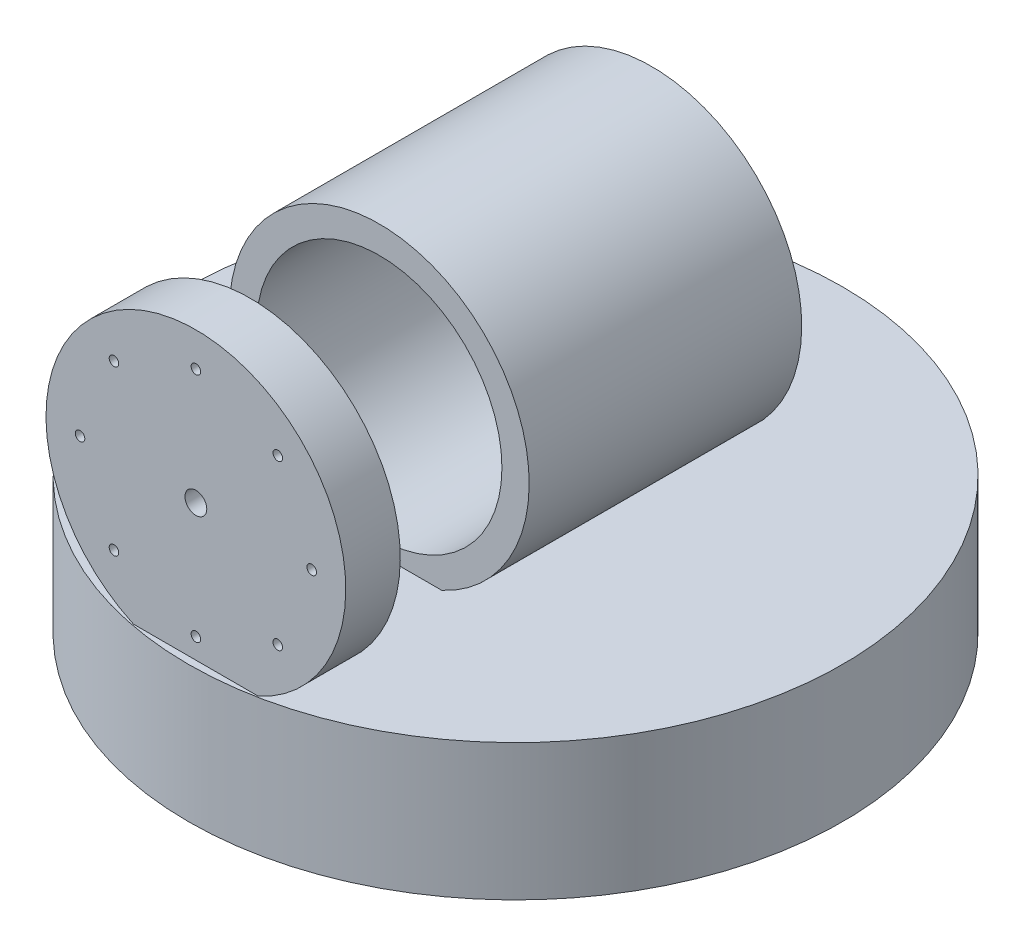
from build123d import *

# Parameters (mm, degrees)
SKETCH_1_R             = 120
EXTRUDE_1_DEPTH        = 50
EXTRUDE_1_2_DEPTH      = 50
EXTRUDE_1_2_DEPTH_BACK = 50
SKETCH_2_R             = 55
SKETCH_2_R_2           = 45
SKETCH_7_R             = 2
CUT_EXTRUDE_2_DEPTH    = 3
SKETCH_8_R             = 55
EXTRUDE_2_DEPTH        = 20
SKETCH_9_R             = 1.75
SKETCH_9_R_2           = 4
CUT_EXTRUDE_3_DEPTH    = 293.65045703


with BuildPart() as part:
    # 草图1 → Extrude 1 (new body)
    with BuildSketch(Plane(origin=(0, 0, 0), x_dir=(1, 0, 0), z_dir=(0, 1, 0))):
        with Locations(Location((0, 0, 0), (0, 0, 270))):
            Circle(SKETCH_1_R)
    extrude(amount=EXTRUDE_1_DEPTH)

    # 草图2 → Extrude 1 2 (add, two sides: drawn at the far end of the back side and taken through both)
    with BuildSketch(Plane.XY.offset(-EXTRUDE_1_2_DEPTH_BACK)):
        with Locations((0, 100)):
            Circle(SKETCH_2_R)
        with Locations((0, 100)):
            Circle(SKETCH_2_R_2, mode=Mode.SUBTRACT)
    extrude(amount=EXTRUDE_1_2_DEPTH + EXTRUDE_1_2_DEPTH_BACK)

    # 草图7 → 切除-拉伸2 (cut)
    with BuildSketch(Plane.XZ):
        with Locations(Location((17.25, 0, 0), (0, 0, 270))):
            Circle(SKETCH_7_R)
        with Locations(Location((8.625, -14.938938215, 0), (0, 0, 270))):
            Circle(SKETCH_7_R)
        with Locations(Location((-8.625, -14.938938215, 0), (0, 0, 270))):
            Circle(SKETCH_7_R)
        with Locations(Location((-17.25, 0, 0), (0, 0, 270))):
            Circle(SKETCH_7_R)
        with Locations(Location((-8.625, 14.938938215, 0), (0, 0, 270))):
            Circle(SKETCH_7_R)
        with Locations(Location((8.625, 14.938938215, 0), (0, 0, 270))):
            Circle(SKETCH_7_R)
    extrude(amount=-CUT_EXTRUDE_2_DEPTH, mode=Mode.SUBTRACT)

    # 草图8 → 凸台-拉伸2 (add)
    with BuildSketch(Plane.XY.offset(97.3)):
        with Locations((0, 100)):
            Circle(SKETCH_8_R)
    extrude(amount=EXTRUDE_2_DEPTH)

    # 草图9 → 切除-拉伸3 (cut, through all)
    with BuildSketch(Plane(origin=(0, 0, 97.3), x_dir=(-1, 0, 0), z_dir=(0, 0, -1))):
        with Locations((42.5, 100)):
            Circle(SKETCH_9_R)
        with Locations((30.0520382, 69.9479618)):
            Circle(SKETCH_9_R)
        with Locations((0, 57.5)):
            Circle(SKETCH_9_R)
        with Locations((-30.0520382, 69.9479618)):
            Circle(SKETCH_9_R)
        with Locations((-42.5, 100)):
            Circle(SKETCH_9_R)
        with Locations((-30.0520382, 130.0520382)):
            Circle(SKETCH_9_R)
        with Locations((0, 142.5)):
            Circle(SKETCH_9_R)
        with Locations((30.0520382, 130.0520382)):
            Circle(SKETCH_9_R)
        with Locations((0, 100)):
            Circle(SKETCH_9_R_2)
    extrude(amount=-CUT_EXTRUDE_3_DEPTH, mode=Mode.SUBTRACT)


solid = part.part
